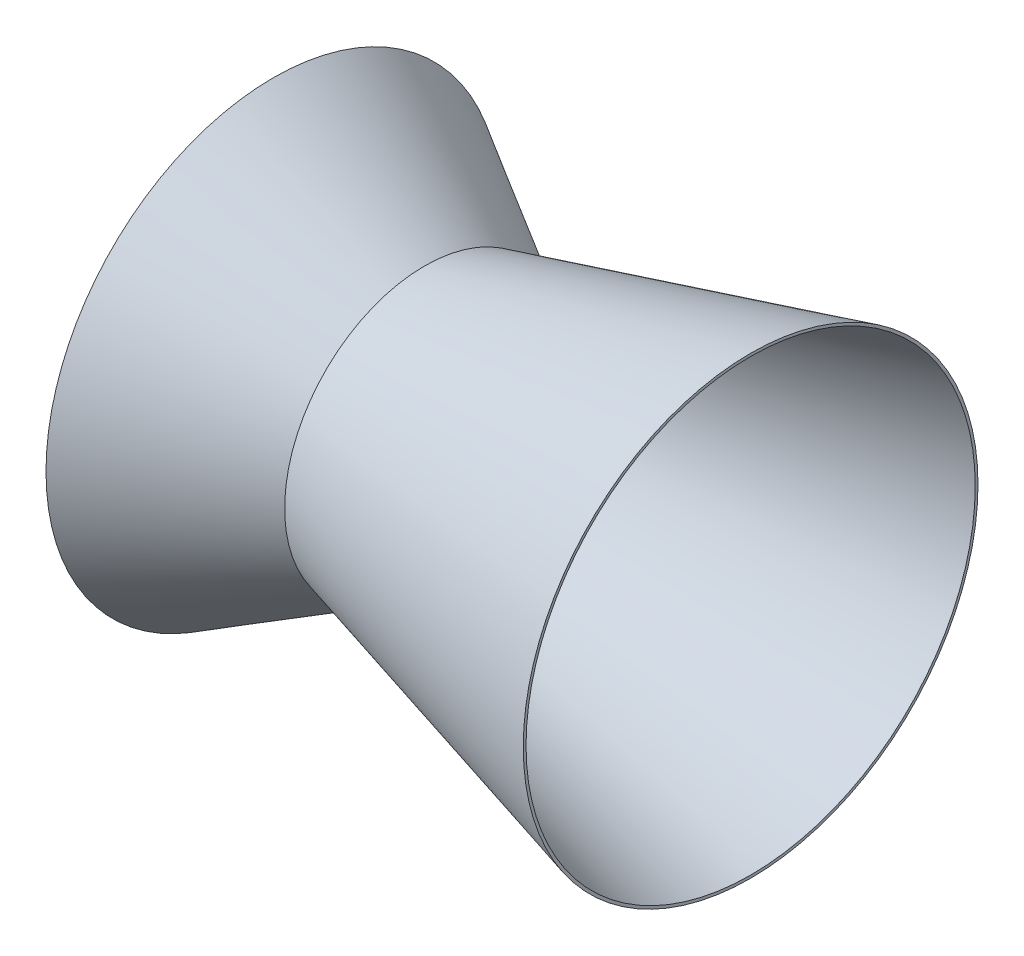
from build123d import *

# Parameters (mm, degrees)
SHELL2_T = -1


with BuildPart() as part:
    # Sketch2 → Revolve1 (revolve)
    with BuildSketch(Plane.XY):
        Polygon((0, 0), (0, 85), (56.558, 52.346), (178.42, 85), (178.42, 0), align=None)
    revolve(axis=Axis((178.42, 0, 0), (-1, 0, 0)))

    # Shell2
    shell2_openings = [part.faces().sort_by_distance(p)[0] for p in [
        (178.42, 0, 0),
        (0, 0, 0),
    ]]
    offset(amount=SHELL2_T, openings=shell2_openings, kind=Kind.INTERSECTION)


solid = part.part
